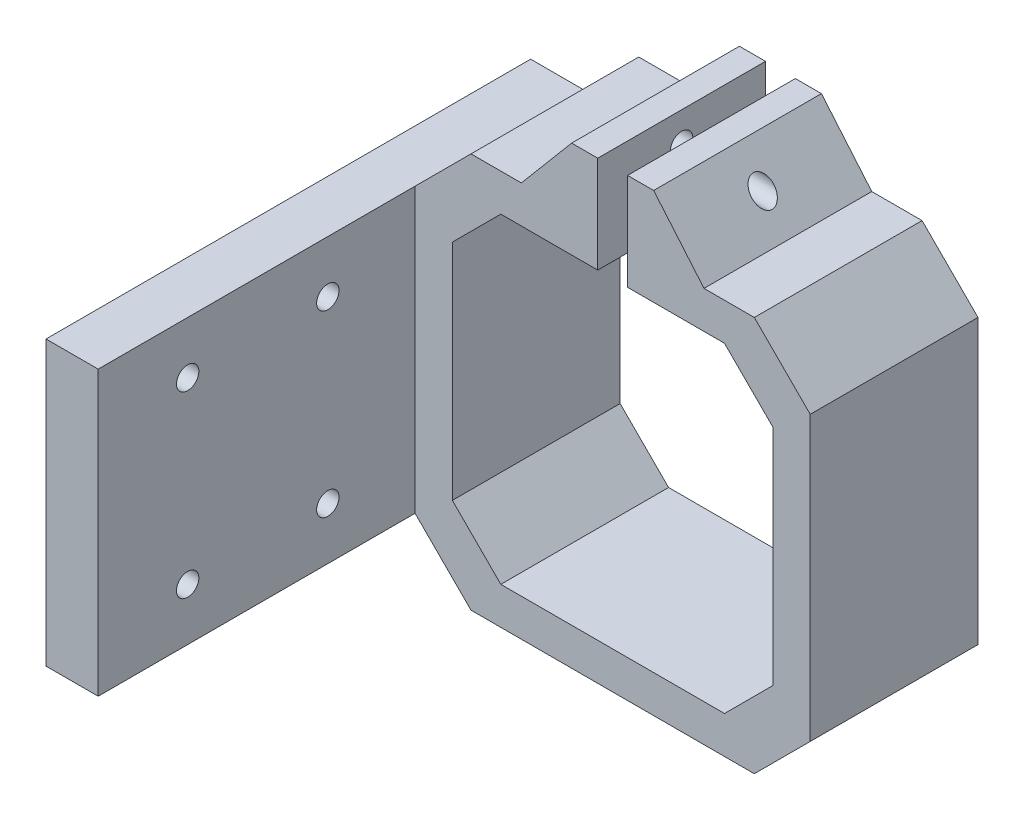
from build123d import *

# Parameters (mm, degrees)
SALIENTE_EXTRUIR1_DEPTH    = 22.5
CROQUIS2_W                 = 7
CROQUIS2_H                 = 38
SALIENTE_EXTRUIR2_DEPTH    = 65
CORTAR_EXTRUIR1_DEPTH      = 81.854808144
CORTAR_EXTRUIR1_DEPTH_BACK = 81.854808144
CROQUIS3_R                 = 1.5


with BuildPart() as part:
    # Croquis1 → Saliente-Extruir1 (new body)
    with BuildSketch(Plane.XY):
        Polygon((-15, 21.5), (-21.5, 15), (-21.5, -15), (-15, -21.5), (15, -21.5), (21.5, -15), (21.5, 15), (15, 21.5), (2, 21.5), (2, 34.5), (5.5, 34.5), (12.25, 26.5), (19, 26.5), (26.5, 19), (26.5, -19), (19, -26.5), (-19, -26.5), (-26.5, -19), (-26.5, 19), (-19, 26.5), (-12.25, 26.5), (-5.5, 34.5), (-2, 34.5), (-2, 21.5), align=None)
    extrude(amount=SALIENTE_EXTRUIR1_DEPTH)

    # Croquis2 → Saliente-Extruir2 (add)
    with BuildSketch(Plane.XY):
        with Locations((-30, 0)):
            Rectangle(CROQUIS2_W, CROQUIS2_H)
    extrude(amount=SALIENTE_EXTRUIR2_DEPTH)

    # Croquis3 → Cortar-Extruir1 (cut, two sides: drawn at the far end of the back side and taken through both)
    with BuildSketch(Plane(origin=(0, 0, 0), x_dir=(0, 0, -1), z_dir=(1, 0, 0)).offset(-CORTAR_EXTRUIR1_DEPTH_BACK)):
        with Locations(Location((-11.25, 30.5, 0), (0, 0, 90))):
            Circle(CROQUIS3_R)
        with Locations((-53, 12)):
            Circle(CROQUIS3_R)
        with Locations((-34.2, 12)):
            Circle(CROQUIS3_R)
        with Locations((-34.2, -12)):
            Circle(CROQUIS3_R)
        with Locations((-53, -12)):
            Circle(CROQUIS3_R)
    extrude(amount=CORTAR_EXTRUIR1_DEPTH + CORTAR_EXTRUIR1_DEPTH_BACK, mode=Mode.SUBTRACT)


solid = part.part
